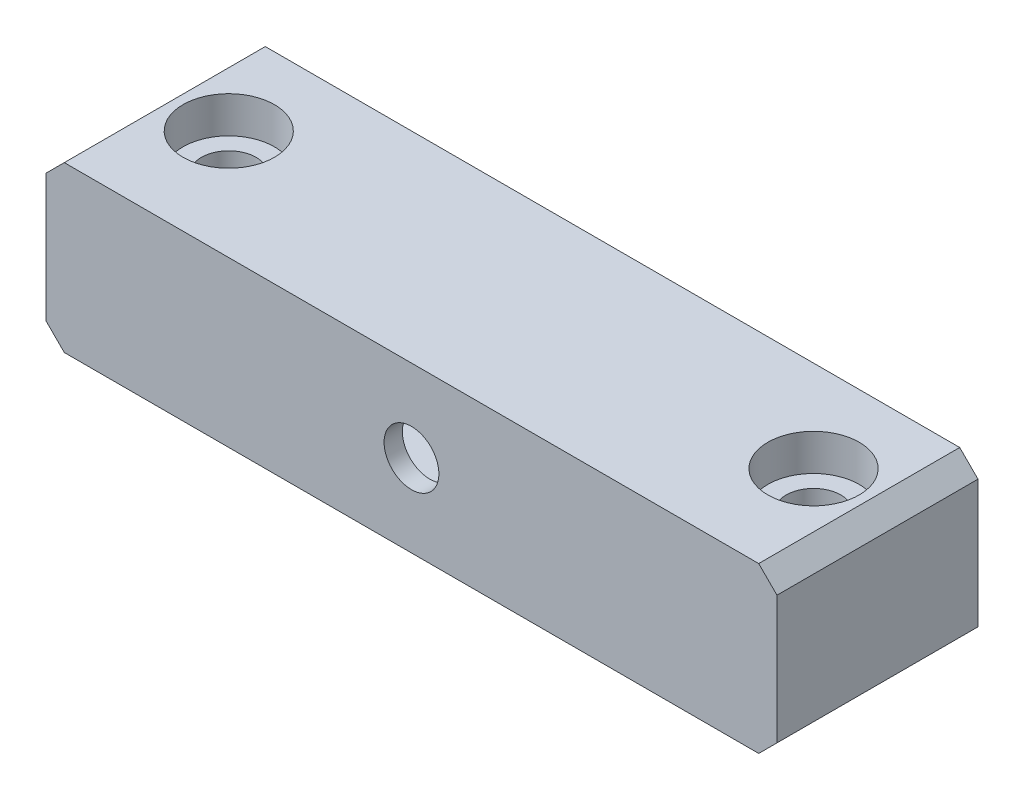
from build123d import *

# Parameters (mm, degrees)
BOSS_EXTRUDE1_DEPTH = 5
BOSS_EXTRUDE2_START = 5
SKETCH2_2_W         = 40
SKETCH2_2_H         = 9
BOSS_EXTRUDE2_DEPTH = 1
CUT_EXTRUDE1_REACH  = 25.265
SKETCH3_R           = 1.5
SKETCH7_R           = 2.5
CUT_EXTRUDE2_DEPTH  = 2
SKETCH7_3_R         = 1.5
CUT_EXTRUDE3_DEPTH  = 23.737634002
CHAMFER1_SIZE       = 1


with BuildPart() as part:
    # Sketch2 → Boss-Extrude1 (new, symmetric)
    with BuildSketch(Plane.XY):
        Polygon((-10, 4.5), (10, 4.5), (20, 4.5), (20, -4.5), (10, -4.5), (-10, -4.5), (-20, -4.5), (-20, 4.5), align=None)
        with BuildLine():
            Line((-10, 3.5), (10, 3.5))
            ThreePointArc((10, 3.5), (13.5, 0), (10, -3.5))
            Line((10, -3.5), (-10, -3.5))
            ThreePointArc((-10, -3.5), (-13.5, 0), (-10, 3.5))
        make_face(mode=Mode.SUBTRACT)
    extrude(amount=BOSS_EXTRUDE1_DEPTH, both=True)

    # Sketch2<2> → Boss-Extrude2 (add)
    with BuildSketch(Plane.XY.offset(BOSS_EXTRUDE2_START)):
        Rectangle(SKETCH2_2_W, SKETCH2_2_H)
    extrude(amount=BOSS_EXTRUDE2_DEPTH)

    # Sketch3 → Cut-Extrude1 (cut, up to next)
    with BuildSketch(Plane.XY.offset(6), mode=Mode.PRIVATE) as cut_extrude1_sk1:
        Circle(SKETCH3_R)
    cut_extrude1_tool1 = extrude(cut_extrude1_sk1.sketch, amount=-CUT_EXTRUDE1_REACH, mode=Mode.PRIVATE) & part.part
    add(cut_extrude1_tool1.solids().sort_by_distance((0, 0, 6))[0], mode=Mode.SUBTRACT)

    # Sketch7 → Cut-Extrude2 (cut)
    with BuildSketch(Plane(origin=(0, 4.5, 0), x_dir=(1, 0, 0), z_dir=(0, 1, 0))):
        with Locations((-16, 0)):
            Circle(SKETCH7_R)
        with Locations((16, 0)):
            Circle(SKETCH7_R)
    extrude(amount=-CUT_EXTRUDE2_DEPTH, mode=Mode.SUBTRACT)

    # Sketch7<3> → Cut-Extrude3 (cut, through all)
    with BuildSketch(Plane(origin=(0, 4.5, 0), x_dir=(1, 0, 0), z_dir=(0, 1, 0))):
        with Locations((-16, 0)):
            Circle(SKETCH7_3_R)
        with Locations((16, 0)):
            Circle(SKETCH7_3_R)
    extrude(amount=-CUT_EXTRUDE3_DEPTH, mode=Mode.SUBTRACT)

    # Chamfer1
    chamfer1_edges = [part.edges().sort_by_distance(p)[0] for p in [
        (-20, -4.5, 0.5),
        (20, -4.5, 0.5),
        (20, 4.5, 0.5),
        (-20, 4.5, 0.5),
    ]]
    chamfer(chamfer1_edges, length=CHAMFER1_SIZE)


solid = part.part
